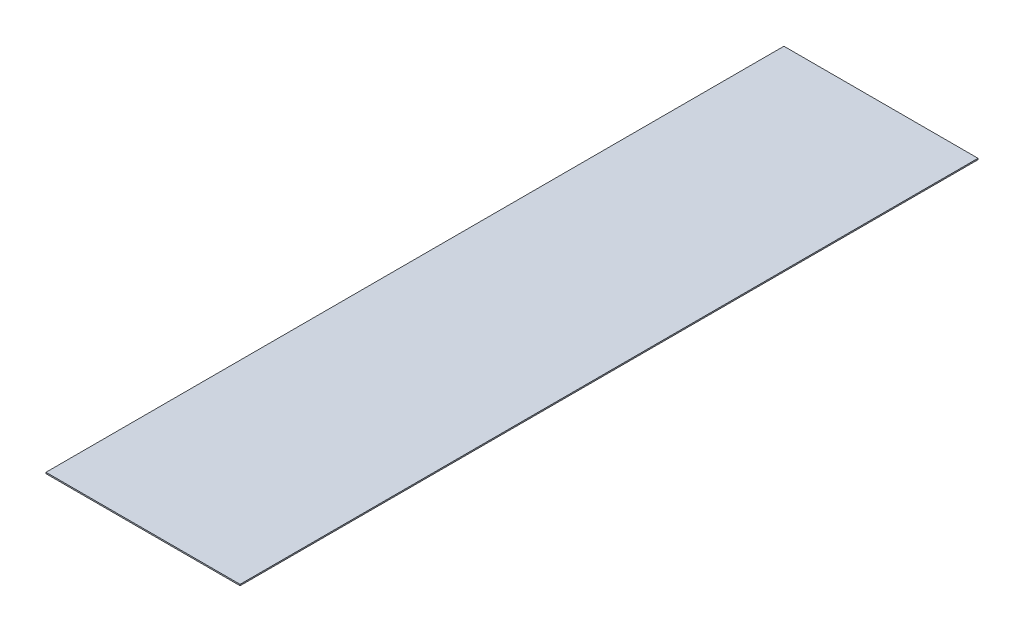
from build123d import *

# Parameters (mm, degrees)
SKETCH1_W           = 481.0125
SKETCH1_H           = 3.175
BOSS_EXTRUDE1_DEPTH = 1828.8


with BuildPart() as part:
    # Sketch1 → Boss-Extrude1 (new body)
    with BuildSketch(Plane.XY):
        Rectangle(SKETCH1_W, SKETCH1_H)
    extrude(amount=BOSS_EXTRUDE1_DEPTH)


solid = part.part
